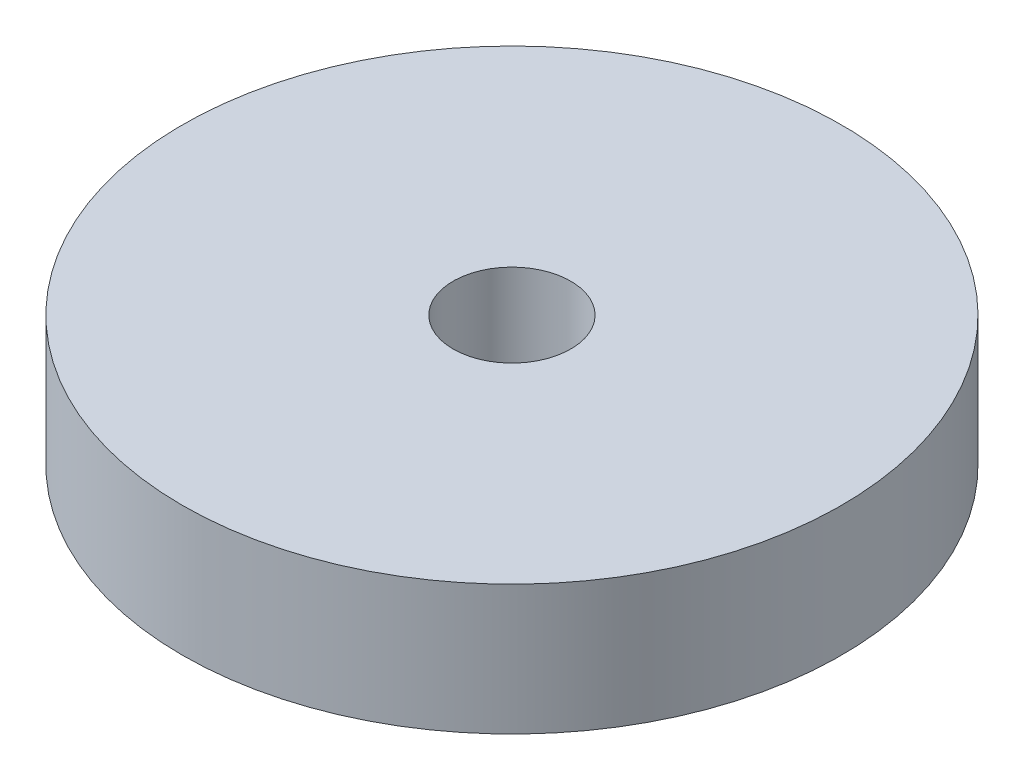
from build123d import *

# Parameters (mm, degrees)
SKETCH1_R           = 162.5
SKETCH1_R_2         = 29
BOSS_EXTRUDE1_DEPTH = 32


with BuildPart() as part:
    # Sketch1 → Boss-Extrude1 (new, symmetric)
    with BuildSketch(Plane(origin=(0, 0, 0), x_dir=(1, 0, 0), z_dir=(0, 1, 0))):
        with Locations(Location((0, 0, 0), (0, 0, 270))):
            Circle(SKETCH1_R)
        with Locations(Location((0, 0, 0), (0, 0, 270))):
            Circle(SKETCH1_R_2, mode=Mode.SUBTRACT)
    extrude(amount=BOSS_EXTRUDE1_DEPTH, both=True)


solid = part.part
